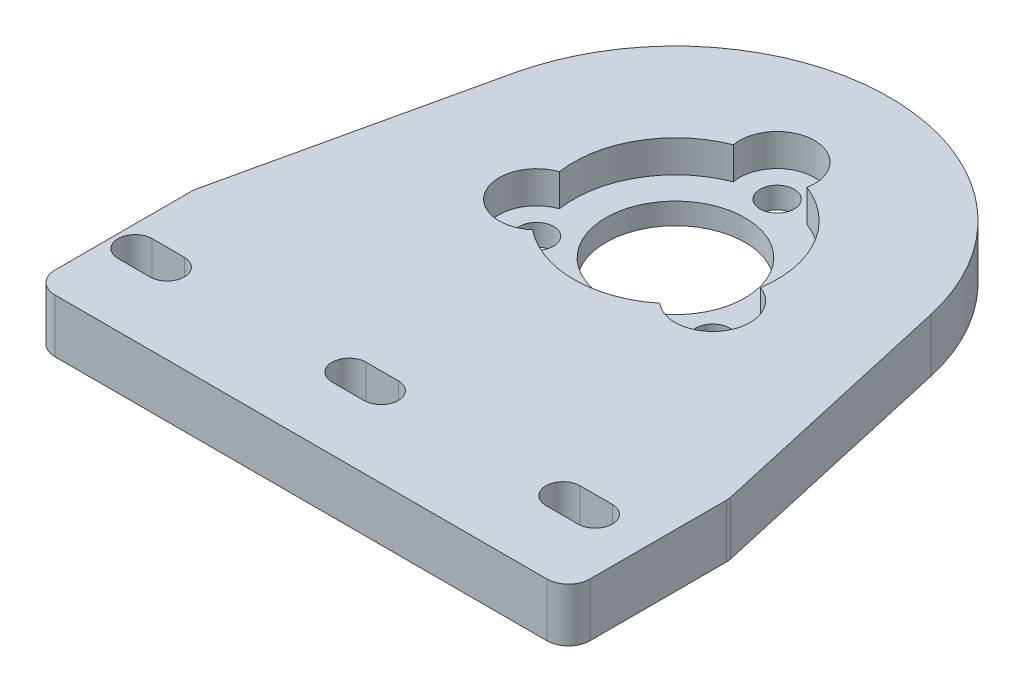
from build123d import *

# Parameters (mm, degrees)
SKETCH_1_R          = 20
SKETCH_1_R_2        = 6.5
SKETCH_1_R_3        = 1.6
EXTRUDE_1_DEPTH     = 5
SKETCH_2_W          = 50
SKETCH_2_H          = 15
SKETCH_2_R          = 1.6
EXTRUDE_2_DEPTH     = 5
EXTRUDE_START       = -5
EXTRUDE_4_DEPTH     = 5
CUT_EXTRUDE_START   = -3
SKETCH_5_R          = 9.5
SKETCH_5_R_2        = 3.5
SKETCH_5_R_3        = 1.6
SKETCH_5_R_4        = 6.5
CUT_EXTRUDE_1_DEPTH = 3
FILLET_1_R          = 2
CUT_EXTRUDE_2_DEPTH = 44.301270189


with BuildPart() as part:
    # 草图1 → 凸台-拉伸1 (new body)
    with BuildSketch(Plane(origin=(0, 0, 0), x_dir=(1, 0, 0), z_dir=(0, 1, 0))):
        with Locations(Location((0, 0, 0), (0, 0, 270))):
            Circle(SKETCH_1_R)
        with Locations(Location((0, 0, 0), (0, 0, 270))):
            Circle(SKETCH_1_R_2, mode=Mode.SUBTRACT)
        with Locations(Location((0, 9.5, 0), (0, 0, 270))):
            Circle(SKETCH_1_R_3, mode=Mode.SUBTRACT)
        with Locations(Location((8.227241336, -4.75, 0), (0, 0, 270))):
            Circle(SKETCH_1_R_3, mode=Mode.SUBTRACT)
        with Locations(Location((-8.227241336, -4.75, 0), (0, 0, 270))):
            Circle(SKETCH_1_R_3, mode=Mode.SUBTRACT)
    extrude(amount=EXTRUDE_1_DEPTH)



with BuildPart() as body_2:
    # 草图2 → 凸台-拉伸2 (new body)
    with BuildSketch(Plane(origin=(0, 5, 0), x_dir=(1, 0, 0), z_dir=(0, 1, 0))):
        with Locations((0, -27.5)):
            Rectangle(SKETCH_2_W, SKETCH_2_H)
        with Locations(Location((-20, -27.5, 0), (0, 0, 270))):
            Circle(SKETCH_2_R, mode=Mode.SUBTRACT)
        with Locations(Location((20, -27.5, 0), (0, 0, 270))):
            Circle(SKETCH_2_R, mode=Mode.SUBTRACT)
        with Locations(Location((0, -27.5, 0), (0, 0, 270))):
            Circle(SKETCH_2_R, mode=Mode.SUBTRACT)
    extrude(amount=-EXTRUDE_2_DEPTH)


with BuildPart() as part_1:
    add(part.part)

    add(body_2.part)  # 凸台-拉伸4 merges body 2
    # 草图4 → 凸台-拉伸4 (add)
    with BuildSketch(Plane(origin=(0, 5, 0), x_dir=(1, 0, 0), z_dir=(0, 1, 0)).offset(EXTRUDE_START)):
        with BuildLine():
            Line((-19.512195122, 4.390243902), (-25, -20))
            Line((-25, -20), (0, -20))
            ThreePointArc((0, -20), (-15.617376189, -12.493900951), (-19.512195122, 4.390243902))
        make_face()
        with BuildLine():
            ThreePointArc((20, 0), (14.142135624, -14.142135624), (0, -20))
            Line((0, -20), (25, -20))
            Line((25, -20), (19.512195122, 4.390243902))
            ThreePointArc((19.512195122, 4.390243902), (19.877674693, 2.208630521), (20, 0))
        make_face()
    extrude(amount=EXTRUDE_4_DEPTH)

    # 草图5 → 切除-拉伸1 (cut)
    # profile 1 of 25: a face of its own
    with BuildSketch(Plane(origin=(0, 5, 0), x_dir=(1, 0, 0), z_dir=(0, 1, 0)).offset(CUT_EXTRUDE_START)):
        Circle(SKETCH_5_R)
    # profile 2 of 25: a face of its own
    with BuildSketch(Plane(origin=(0, 5, 0), x_dir=(1, 0, 0), z_dir=(0, 1, 0)).offset(CUT_EXTRUDE_START)):
        with Locations((-8.227241336, -4.75)):
            Circle(SKETCH_5_R_2)
        with Locations(Location((-8.227241336, -4.75, 0), (0, 0, 270))):
            Circle(SKETCH_5_R_3, mode=Mode.SUBTRACT)
    # profile 3 of 25: a face of its own
    with BuildSketch(Plane(origin=(0, 5, 0), x_dir=(1, 0, 0), z_dir=(0, 1, 0)).offset(CUT_EXTRUDE_START)):
        with Locations((-8.227241336, -4.75)):
            Circle(SKETCH_5_R_2)
        with Locations(Location((-8.227241336, -4.75, 0), (0, 0, 270))):
            Circle(SKETCH_5_R_3, mode=Mode.SUBTRACT)
    # profile 4 of 25: a face of its own
    with BuildSketch(Plane(origin=(0, 5, 0), x_dir=(1, 0, 0), z_dir=(0, 1, 0)).offset(CUT_EXTRUDE_START)):
        Circle(SKETCH_5_R)
        with Locations(Location((0, 0, 0), (0, 0, 270))):
            Circle(SKETCH_5_R_4, mode=Mode.SUBTRACT)
    # profile 5 of 25: a face of its own
    with BuildSketch(Plane(origin=(0, 5, 0), x_dir=(1, 0, 0), z_dir=(0, 1, 0)).offset(CUT_EXTRUDE_START)):
        with Locations((-8.227241336, -4.75)):
            Circle(SKETCH_5_R_2)
    # profile 6 of 25: a face of its own
    with BuildSketch(Plane(origin=(0, 5, 0), x_dir=(1, 0, 0), z_dir=(0, 1, 0)).offset(CUT_EXTRUDE_START)):
        with Locations((0, 9.5)):
            Circle(SKETCH_5_R_2)
    # profile 7 of 25: a face of its own
    with BuildSketch(Plane(origin=(0, 5, 0), x_dir=(1, 0, 0), z_dir=(0, 1, 0)).offset(CUT_EXTRUDE_START)):
        Circle(SKETCH_5_R)
        with Locations(Location((0, 0, 0), (0, 0, 270))):
            Circle(SKETCH_5_R_4, mode=Mode.SUBTRACT)
    # profile 8 of 25: a face of its own
    with BuildSketch(Plane(origin=(0, 5, 0), x_dir=(1, 0, 0), z_dir=(0, 1, 0)).offset(CUT_EXTRUDE_START)):
        with Locations((-8.227241336, -4.75)):
            Circle(SKETCH_5_R_2)
    # profile 9 of 25: a face of its own
    with BuildSketch(Plane(origin=(0, 5, 0), x_dir=(1, 0, 0), z_dir=(0, 1, 0)).offset(CUT_EXTRUDE_START)):
        with Locations((0, 9.5)):
            Circle(SKETCH_5_R_2)
        with Locations(Location((0, 9.5, 0), (0, 0, 270))):
            Circle(SKETCH_5_R_3, mode=Mode.SUBTRACT)
    # profile 10 of 25: a face of its own
    with BuildSketch(Plane(origin=(0, 5, 0), x_dir=(1, 0, 0), z_dir=(0, 1, 0)).offset(CUT_EXTRUDE_START)):
        Circle(SKETCH_5_R)
        with Locations(Location((0, 0, 0), (0, 0, 270))):
            Circle(SKETCH_5_R_4, mode=Mode.SUBTRACT)
    # profile 11 of 25: a face of its own
    with BuildSketch(Plane(origin=(0, 5, 0), x_dir=(1, 0, 0), z_dir=(0, 1, 0)).offset(CUT_EXTRUDE_START)):
        Circle(SKETCH_5_R)
    # profile 12 of 25: a face of its own
    with BuildSketch(Plane(origin=(0, 5, 0), x_dir=(1, 0, 0), z_dir=(0, 1, 0)).offset(CUT_EXTRUDE_START)):
        with Locations((0, 9.5)):
            Circle(SKETCH_5_R_2)
        with Locations(Location((0, 9.5, 0), (0, 0, 270))):
            Circle(SKETCH_5_R_3, mode=Mode.SUBTRACT)
    # profile 13 of 25: a face of its own
    with BuildSketch(Plane(origin=(0, 5, 0), x_dir=(1, 0, 0), z_dir=(0, 1, 0)).offset(CUT_EXTRUDE_START)):
        Circle(SKETCH_5_R)
    # profile 14 of 25: a face of its own
    with BuildSketch(Plane(origin=(0, 5, 0), x_dir=(1, 0, 0), z_dir=(0, 1, 0)).offset(CUT_EXTRUDE_START)):
        with Locations((8.227241336, -4.75)):
            Circle(SKETCH_5_R_2)
        with Locations(Location((8.227241336, -4.75, 0), (0, 0, 270))):
            Circle(SKETCH_5_R_3, mode=Mode.SUBTRACT)
    # profile 15 of 25: a face of its own
    with BuildSketch(Plane(origin=(0, 5, 0), x_dir=(1, 0, 0), z_dir=(0, 1, 0)).offset(CUT_EXTRUDE_START)):
        with Locations((8.227241336, -4.75)):
            Circle(SKETCH_5_R_2)
        with Locations(Location((8.227241336, -4.75, 0), (0, 0, 270))):
            Circle(SKETCH_5_R_3, mode=Mode.SUBTRACT)
    # profile 16 of 25: a face of its own
    with BuildSketch(Plane(origin=(0, 5, 0), x_dir=(1, 0, 0), z_dir=(0, 1, 0)).offset(CUT_EXTRUDE_START)):
        Circle(SKETCH_5_R)
        with Locations(Location((0, 0, 0), (0, 0, 270))):
            Circle(SKETCH_5_R_4, mode=Mode.SUBTRACT)
    # profile 17 of 25: a face of its own
    with BuildSketch(Plane(origin=(0, 5, 0), x_dir=(1, 0, 0), z_dir=(0, 1, 0)).offset(CUT_EXTRUDE_START)):
        with Locations((8.227241336, -4.75)):
            Circle(SKETCH_5_R_2)
    # profile 18 of 25: a face of its own
    with BuildSketch(Plane(origin=(0, 5, 0), x_dir=(1, 0, 0), z_dir=(0, 1, 0)).offset(CUT_EXTRUDE_START)):
        Circle(SKETCH_5_R)
        with Locations(Location((0, 0, 0), (0, 0, 270))):
            Circle(SKETCH_5_R_4, mode=Mode.SUBTRACT)
    # profile 19 of 25: a face of its own
    with BuildSketch(Plane(origin=(0, 5, 0), x_dir=(1, 0, 0), z_dir=(0, 1, 0)).offset(CUT_EXTRUDE_START)):
        with Locations((0, 9.5)):
            Circle(SKETCH_5_R_2)
    # profile 20 of 25: a face of its own
    with BuildSketch(Plane(origin=(0, 5, 0), x_dir=(1, 0, 0), z_dir=(0, 1, 0)).offset(CUT_EXTRUDE_START)):
        with Locations((-8.227241336, -4.75)):
            Circle(SKETCH_5_R_2)
    # profile 21 of 25: a face of its own
    with BuildSketch(Plane(origin=(0, 5, 0), x_dir=(1, 0, 0), z_dir=(0, 1, 0)).offset(CUT_EXTRUDE_START)):
        Circle(SKETCH_5_R)
        with Locations(Location((0, 0, 0), (0, 0, 270))):
            Circle(SKETCH_5_R_4, mode=Mode.SUBTRACT)
    # profile 22 of 25: a face of its own
    with BuildSketch(Plane(origin=(0, 5, 0), x_dir=(1, 0, 0), z_dir=(0, 1, 0)).offset(CUT_EXTRUDE_START)):
        with Locations(Location((0, 0, 0), (0, 0, 270))):
            Circle(SKETCH_5_R_4)
    # profile 23 of 25: a face of its own
    with BuildSketch(Plane(origin=(0, 5, 0), x_dir=(1, 0, 0), z_dir=(0, 1, 0)).offset(CUT_EXTRUDE_START)):
        with Locations((8.227241336, -4.75)):
            Circle(SKETCH_5_R_2)
    # profile 24 of 25: a face of its own
    with BuildSketch(Plane(origin=(0, 5, 0), x_dir=(1, 0, 0), z_dir=(0, 1, 0)).offset(CUT_EXTRUDE_START)):
        with Locations((8.227241336, -4.75)):
            Circle(SKETCH_5_R_2)
    # profile 25 of 25: a face of its own
    with BuildSketch(Plane(origin=(0, 5, 0), x_dir=(1, 0, 0), z_dir=(0, 1, 0)).offset(CUT_EXTRUDE_START)):
        with Locations(Location((0, 0, 0), (0, 0, 270))):
            Circle(SKETCH_5_R_4)
    extrude(amount=CUT_EXTRUDE_1_DEPTH, mode=Mode.SUBTRACT)

    # 圆角1
    fillet_1_edges = [part_1.edges().sort_by_distance(p)[0] for p in [
        (-25, 2.5, 20),
        (25, 2.5, 20),
        (25, 2.5, 35),
        (-25, 2.5, 35),
    ]]
    fillet(fillet_1_edges, radius=FILLET_1_R)

    # 草图6 → 切除-拉伸2 (cut, through all)
    with BuildSketch(Plane.XZ):
        with BuildLine():
            Line((20, 25.9), (17, 25.9))
            ThreePointArc((17, 25.9), (15.4, 27.5), (17, 29.1))
            Line((17, 29.1), (20, 29.1))
            ThreePointArc((20, 29.1), (21.6, 27.5), (20, 25.9))
        make_face()
        with BuildLine():
            Line((0, 25.9), (-3, 25.9))
            ThreePointArc((-3, 25.9), (-4.6, 27.5), (-3, 29.1))
            Line((-3, 29.1), (0, 29.1))
            ThreePointArc((0, 29.1), (1.6, 27.5), (0, 25.9))
        make_face()
        with BuildLine():
            Line((-20, 25.9), (-23, 25.9))
            ThreePointArc((-23, 25.9), (-24.6, 27.5), (-23, 29.1))
            Line((-23, 29.1), (-20, 29.1))
            ThreePointArc((-20, 29.1), (-18.4, 27.5), (-20, 25.9))
        make_face()
    extrude(amount=-CUT_EXTRUDE_2_DEPTH, mode=Mode.SUBTRACT)


solid = part_1.part
